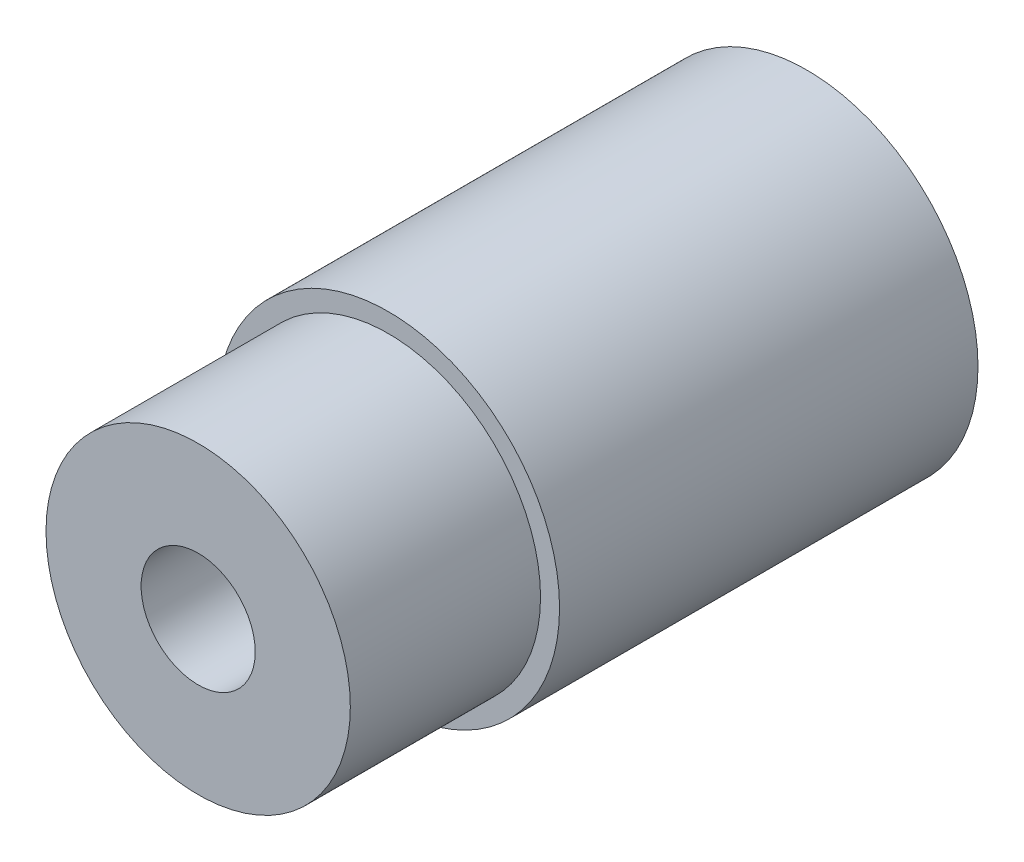
from build123d import *

# Parameters (mm, degrees)
SKETCH_1_R          = 8
EXTRUDE_1_DEPTH     = 32
SKETCH_2_R          = 9
EXTRUDE_2_DEPTH     = 22
CUT_EXTRUDE_1_REACH = 36.438
SKETCH_3_R          = 3


with BuildPart() as part:
    # 草图1 → 凸台-拉伸1 (new body)
    with BuildSketch(Plane.XY):
        Circle(SKETCH_1_R)
    extrude(amount=EXTRUDE_1_DEPTH)

    # 草图2 → 凸台-拉伸2 (add)
    with BuildSketch(Plane(origin=(0, 0, 0), x_dir=(-1, 0, 0), z_dir=(0, 0, -1))):
        Circle(SKETCH_2_R)
    extrude(amount=-EXTRUDE_2_DEPTH)

    # 草图3 → 切除-拉伸1 (cut, up to next)
    with BuildSketch(Plane.XY.offset(32), mode=Mode.PRIVATE) as cut_extrude_1_sk1:
        Circle(SKETCH_3_R)
    cut_extrude_1_tool1 = extrude(cut_extrude_1_sk1.sketch, amount=-CUT_EXTRUDE_1_REACH, mode=Mode.PRIVATE) & part.part
    add(cut_extrude_1_tool1.solids().sort_by_distance((0, 0, 32))[0], mode=Mode.SUBTRACT)


solid = part.part
